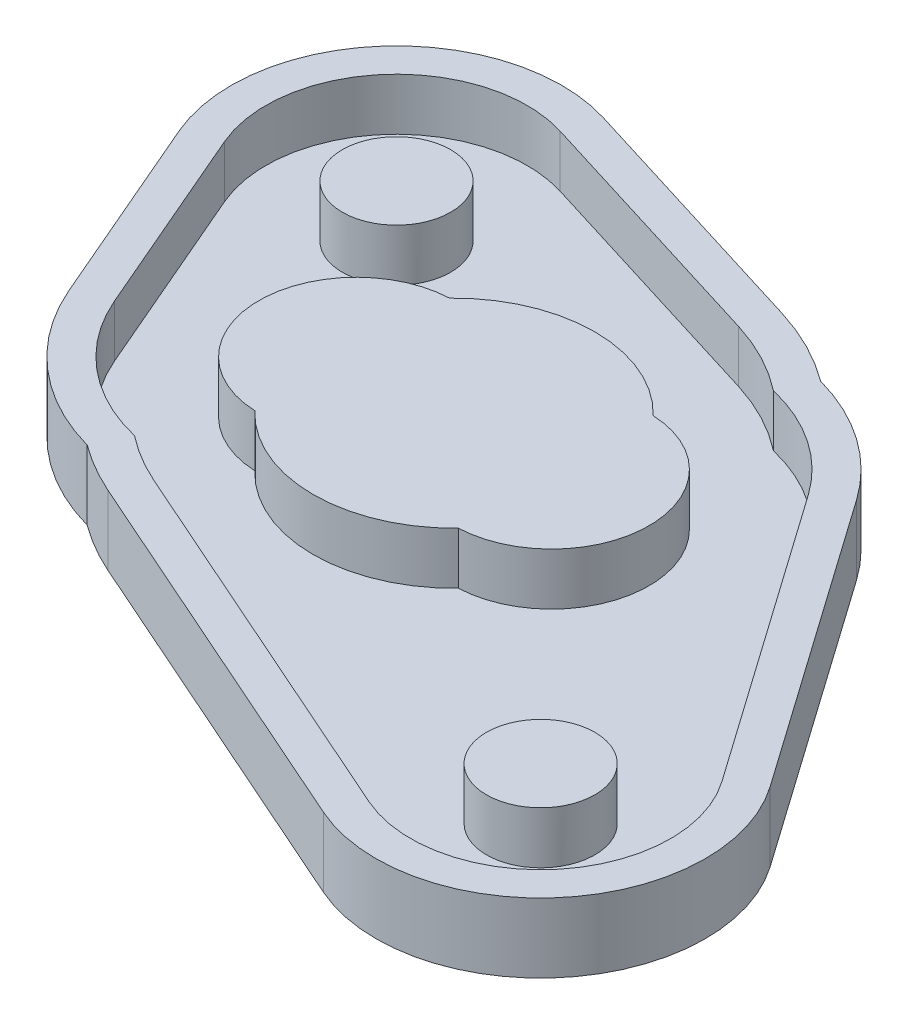
from build123d import *

# Parameters (mm, degrees)
SKETCH1_R             = 3.125
BOSS_EXTRUDE1_DEPTH   = 3
BOSS_EXTRUDE1_2_DEPTH = 3
BOSS_EXTRUDE1_3_DEPTH = 3
BOSS_EXTRUDE1_4_DEPTH = 3
BOSS_EXTRUDE2_DEPTH   = 1


with BuildPart() as part:
    # Sketch1 → Boss-Extrude1 (new body)
    with BuildSketch(Plane(origin=(0, 0, 0), x_dir=(1, 0, 0), z_dir=(0, 1, 0))):
        with Locations(Location((20, -15, 0), (0, 0, 270))):
            Circle(SKETCH1_R)
    extrude(amount=BOSS_EXTRUDE1_DEPTH)



with BuildPart() as body_2:
    # Sketch1 → Boss-Extrude1 2 (new body)
    with BuildSketch(Plane(origin=(0, 0, 0), x_dir=(1, 0, 0), z_dir=(0, 1, 0))):
        with Locations(Location((-13.25542136, 9.94156602, 0), (0, 0, 270))):
            Circle(SKETCH1_R)
    extrude(amount=BOSS_EXTRUDE1_2_DEPTH)


with BuildPart() as body_3:
    # Sketch1 → Boss-Extrude1 3 (new body)
    with BuildSketch(Plane(origin=(0, 0, 0), x_dir=(1, 0, 0), z_dir=(0, 1, 0))):
        with BuildLine():
            Line((-6.119805779, -13.831616038), (16.156155048, -23.687626603))
            ThreePointArc((16.156155048, -23.687626603), (27.344292117, -21.025891909), (27.769542612, -9.533354996))
            Line((27.769542612, -9.533354996), (15.950313209, 7.264883492))
            ThreePointArc((15.950313209, 7.264883492), (12.8913772, 10.324262075), (8.979166667, 12.17128551))
            ThreePointArc((8.979166667, 12.17128551), (6.819498906, 13.500372575), (4.468133972, 14.44996207))
            Line((4.468133972, 14.44996207), (-10.436297143, 19.05862434))
            ThreePointArc((-10.436297143, 19.05862434), (-20.352140796, 16.321596348), (-22.022063001, 6.171392537))
            Line((-22.022063001, 6.171392537), (-17.222949988, -4.987803231))
            ThreePointArc((-17.222949988, -4.987803231), (-13.919097451, -9.518328239), (-8.979166667, -12.17128551))
            ThreePointArc((-8.979166667, -12.17128551), (-7.594992863, -13.079820657), (-6.119805779, -13.831616038))
        make_face()
        with BuildLine():
            Line((-5.310575263, -12.002642017), (16.965385564, -21.858652581))
            ThreePointArc((16.965385564, -21.858652581), (25.798125356, -19.757283086), (26.133849431, -10.684227629))
            Line((26.133849431, -10.684227629), (14.314620027, 6.114010859))
            ThreePointArc((14.314620027, 6.114010859), (11.588405557, 8.793657895), (8.090277778, 10.335038968))
            ThreePointArc((8.090277778, 10.335038968), (6.084437075, 11.62949915), (3.877306339, 12.539223283))
            Line((3.877306339, 12.539223283), (-11.027124776, 17.147885554))
            ThreePointArc((-11.027124776, 17.147885554), (-18.864821465, 14.984479597), (-20.184763993, 6.961539583))
            Line((-20.184763993, 6.961539583), (-15.38565098, -4.197656185))
            ThreePointArc((-15.38565098, -4.197656185), (-12.464970786, -8.130524254), (-8.090277778, -10.335038968))
            ThreePointArc((-8.090277778, -10.335038968), (-6.752106378, -11.254984872), (-5.310575263, -12.002642017))
        make_face(mode=Mode.SUBTRACT)
    extrude(amount=BOSS_EXTRUDE1_3_DEPTH)


with BuildPart() as body_4:
    # Sketch1 → Boss-Extrude1 4 (new body)
    with BuildSketch(Plane(origin=(0, 0, 0), x_dir=(1, 0, 0), z_dir=(0, 1, 0))):
        with BuildLine():
            ThreePointArc((-5.868055556, -5.619746346), (0, -8.125), (5.868055556, -5.619746346))
            ThreePointArc((5.868055556, -5.619746346), (11.25, 0), (5.868055556, 5.619746346))
            ThreePointArc((5.868055556, 5.619746346), (0, 8.125), (-5.868055556, 5.619746346))
            ThreePointArc((-5.868055556, 5.619746346), (-11.25, 0), (-5.868055556, -5.619746346))
        make_face()
    extrude(amount=BOSS_EXTRUDE1_4_DEPTH)


with BuildPart() as part_1:
    add(part.part)

    add(body_2.part)  # Boss-Extrude2 merges body 2

    add(body_3.part)  # Boss-Extrude2 merges body 3

    add(body_4.part)  # Boss-Extrude2 merges body 4
    # Sketch2 → Boss-Extrude2 (add)
    with BuildSketch(Plane.XZ):
        with BuildLine():
            Line((-17.222949988, 4.987803231), (-22.022063001, -6.171392537))
            ThreePointArc((-22.022063001, -6.171392537), (-20.352140796, -16.321596348), (-10.436297143, -19.05862434))
            Line((-10.436297143, -19.05862434), (4.468133972, -14.44996207))
            ThreePointArc((4.468133972, -14.44996207), (6.819498906, -13.500372575), (8.979166667, -12.17128551))
            ThreePointArc((8.979166667, -12.17128551), (12.8913772, -10.324262075), (15.950313209, -7.264883492))
            Line((15.950313209, -7.264883492), (27.769542612, 9.533354996))
            ThreePointArc((27.769542612, 9.533354996), (27.344292117, 21.025891909), (16.156155048, 23.687626603))
            Line((16.156155048, 23.687626603), (-6.119805779, 13.831616038))
            ThreePointArc((-6.119805779, 13.831616038), (-7.594992863, 13.079820657), (-8.979166667, 12.17128551))
            ThreePointArc((-8.979166667, 12.17128551), (-13.919097451, 9.518328239), (-17.222949988, 4.987803231))
        make_face()
    extrude(amount=BOSS_EXTRUDE2_DEPTH)


solid = part_1.part
